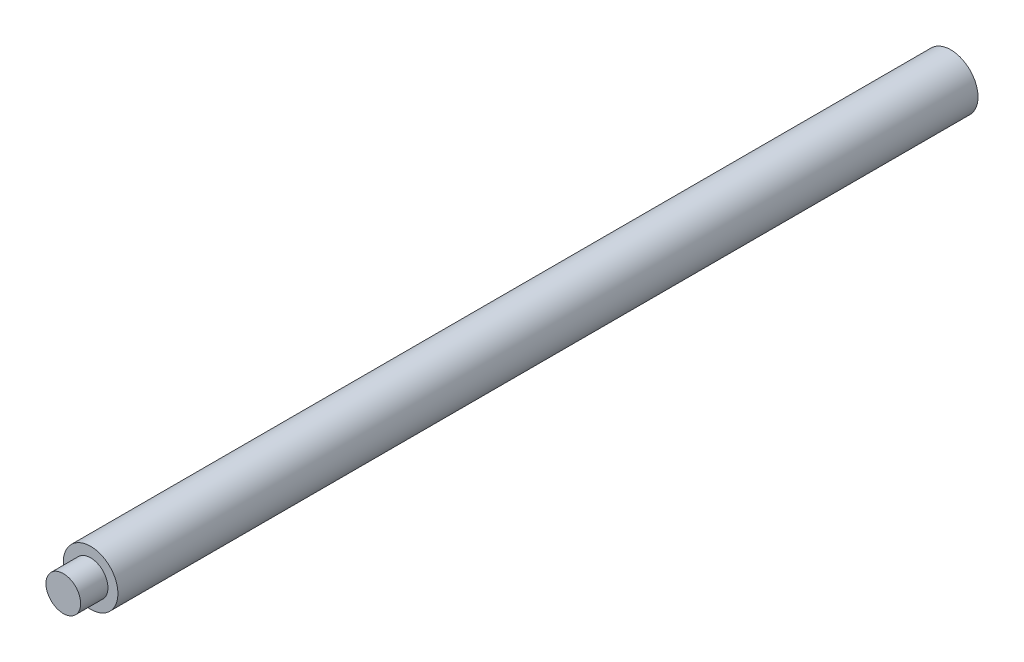
from build123d import *

# Parameters (mm, degrees)
SKETCH1_R           = 10
SKETCH1_R_2         = 8
BOSS_EXTRUDE1_DEPTH = 305
SKETCH2_R           = 10
BOSS_EXTRUDE2_DEPTH = 10
SKETCH3_R           = 6.35
BOSS_EXTRUDE3_DEPTH = 10


with BuildPart() as part:
    # Sketch1 → Boss-Extrude1 (new body)
    with BuildSketch(Plane.XY):
        Circle(SKETCH1_R)
        Circle(SKETCH1_R_2, mode=Mode.SUBTRACT)
    extrude(amount=BOSS_EXTRUDE1_DEPTH)

    # Sketch2 → Boss-Extrude2 (add)
    with BuildSketch(Plane.XY.offset(305)):
        Circle(SKETCH2_R)
    extrude(amount=BOSS_EXTRUDE2_DEPTH)

    # Sketch3 → Boss-Extrude3 (add)
    with BuildSketch(Plane.XY.offset(315)):
        Circle(SKETCH3_R)
    extrude(amount=BOSS_EXTRUDE3_DEPTH)


solid = part.part
